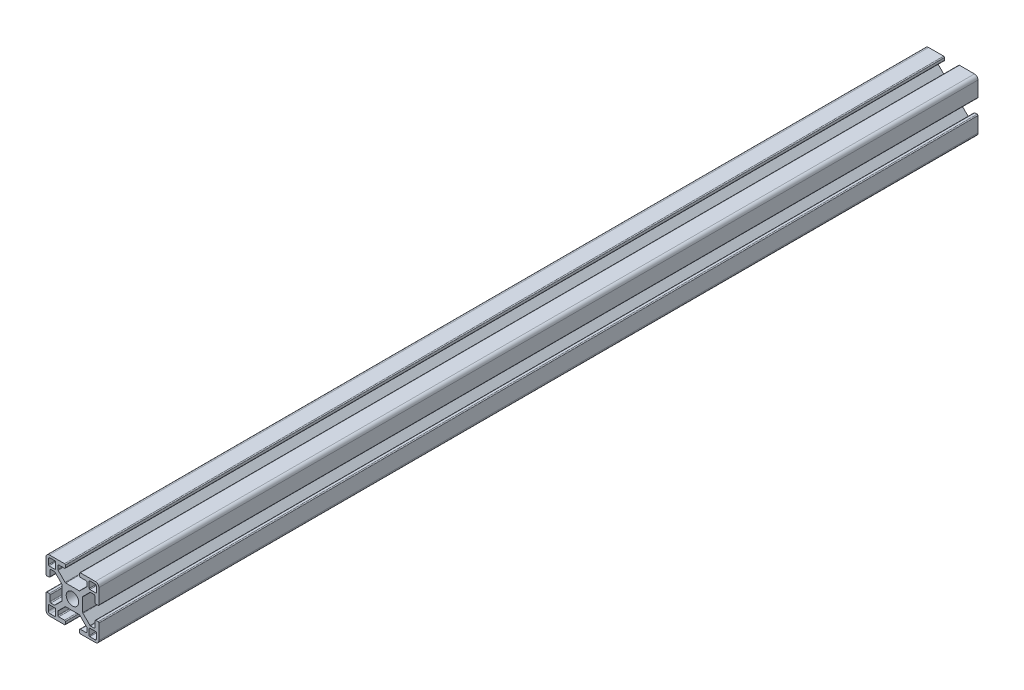
from build123d import *

# Parameters (mm, degrees)
SKETCH1_R           = 3.52998588
BOSS_EXTRUDE1_DEPTH = 249.32


with BuildPart() as part:
    # Sketch1 → Boss-Extrude1 (new, symmetric)
    with BuildSketch(Plane.XY):
        with BuildLine():
            Line((14.49994, -4), (13.24247465, -4))
            ThreePointArc((13.24247465, -4), (12.88892126, -4.146446609), (12.74247465, -4.5))
            Line((12.74247465, -4.5), (12.74247465, -7.732519321))
            ThreePointArc((12.74247465, -7.732519321), (12.602449697, -8.097296796), (12.242781236, -8.249967))
            Line((12.242781236, -8.249967), (10.260188032, -8.249967))
            ThreePointArc((10.260188032, -8.249967), (10.068847082, -8.211906919), (9.906636056, -8.103520976))
            Line((9.906636056, -8.103520976), (5.981117769, -4.178002689))
            ThreePointArc((5.981117769, -4.178002689), (5.872731827, -4.015791664), (5.834671745, -3.824450713))
            Line((5.834671745, -3.824450713), (5.834671745, -1.01249595))
            Line((5.834671745, -1.01249595), (5.834671745, 0.88749645))
            Line((5.834671745, 0.88749645), (5.834671745, 3.824450713))
            ThreePointArc((5.834671745, 3.824450713), (5.872731827, 4.015791664), (5.981117769, 4.178002689))
            Line((5.981117769, 4.178002689), (9.906636056, 8.103520976))
            ThreePointArc((9.906636056, 8.103520976), (10.068847082, 8.211906919), (10.260188032, 8.249967))
            Line((10.260188032, 8.249967), (12.242781236, 8.249967))
            ThreePointArc((12.242781236, 8.249967), (12.602449697, 8.097296796), (12.74247465, 7.732519321))
            Line((12.74247465, 7.732519321), (12.74247465, 4.5))
            ThreePointArc((12.74247465, 4.5), (12.88892126, 4.146446609), (13.24247465, 4))
            Line((13.24247465, 4), (14.49994, 4))
            ThreePointArc((14.49994, 4), (14.853493391, 4.146446609), (14.99994, 4.5))
            Line((14.99994, 4.5), (14.99994, 12.999948))
            ThreePointArc((14.99994, 12.999948), (14.414155906, 14.414155906), (12.999948, 14.99994))
            Line((12.999948, 14.99994), (4.5, 14.99994))
            ThreePointArc((4.5, 14.99994), (4.146446609, 14.853493391), (4, 14.49994))
            Line((4, 14.49994), (4, 13.24247465))
            ThreePointArc((4, 13.24247465), (4.146446609, 12.88892126), (4.5, 12.74247465))
            Line((4.5, 12.74247465), (7.732519321, 12.74247465))
            ThreePointArc((7.732519321, 12.74247465), (8.097296796, 12.602449697), (8.249967, 12.242781236))
            Line((8.249967, 12.242781236), (8.249967, 10.260188032))
            ThreePointArc((8.249967, 10.260188032), (8.211906919, 10.068847082), (8.103520976, 9.906636056))
            Line((8.103520976, 9.906636056), (4.178002689, 5.981117769))
            ThreePointArc((4.178002689, 5.981117769), (4.015791664, 5.872731827), (3.824450713, 5.834671745))
            Line((3.824450713, 5.834671745), (0.9499962, 5.834671745))
            Line((0.9499962, 5.834671745), (-0.9499962, 5.834671745))
            Line((-0.9499962, 5.834671745), (-3.824450713, 5.834671745))
            ThreePointArc((-3.824450713, 5.834671745), (-4.015791664, 5.872731827), (-4.178002689, 5.981117769))
            Line((-4.178002689, 5.981117769), (-8.103520976, 9.906636056))
            ThreePointArc((-8.103520976, 9.906636056), (-8.211906919, 10.068847082), (-8.249967, 10.260188032))
            Line((-8.249967, 10.260188032), (-8.249967, 12.242781236))
            ThreePointArc((-8.249967, 12.242781236), (-8.097296796, 12.602449697), (-7.732519321, 12.74247465))
            Line((-7.732519321, 12.74247465), (-4.5, 12.74247465))
            ThreePointArc((-4.5, 12.74247465), (-4.146446609, 12.88892126), (-4, 13.24247465))
            Line((-4, 13.24247465), (-4, 14.49994))
            ThreePointArc((-4, 14.49994), (-4.146446609, 14.853493391), (-4.5, 14.99994))
            Line((-4.5, 14.99994), (-12.999948, 14.99994))
            ThreePointArc((-12.999948, 14.99994), (-14.414155906, 14.414155906), (-14.99994, 12.999948))
            Line((-14.99994, 12.999948), (-14.99994, 4.5))
            ThreePointArc((-14.99994, 4.5), (-14.853493391, 4.146446609), (-14.49994, 4))
            Line((-14.49994, 4), (-13.24247465, 4))
            ThreePointArc((-13.24247465, 4), (-12.88892126, 4.146446609), (-12.74247465, 4.5))
            Line((-12.74247465, 4.5), (-12.74247465, 7.732519321))
            ThreePointArc((-12.74247465, 7.732519321), (-12.602449697, 8.097296796), (-12.242781236, 8.249967))
            Line((-12.242781236, 8.249967), (-10.260188032, 8.249967))
            ThreePointArc((-10.260188032, 8.249967), (-10.068847082, 8.211906919), (-9.906636056, 8.103520976))
            Line((-9.906636056, 8.103520976), (-5.981117769, 4.178002689))
            ThreePointArc((-5.981117769, 4.178002689), (-5.872731827, 4.015791664), (-5.834671745, 3.824450713))
            Line((-5.834671745, 3.824450713), (-5.834671745, 0.88749645))
            Line((-5.834671745, 0.88749645), (-5.834671745, -1.01249595))
            Line((-5.834671745, -1.01249595), (-5.834671745, -3.824450713))
            ThreePointArc((-5.834671745, -3.824450713), (-5.872731827, -4.015791664), (-5.981117769, -4.178002689))
            Line((-5.981117769, -4.178002689), (-9.906636056, -8.103520976))
            ThreePointArc((-9.906636056, -8.103520976), (-10.068847082, -8.211906919), (-10.260188032, -8.249967))
            Line((-10.260188032, -8.249967), (-12.242781236, -8.249967))
            ThreePointArc((-12.242781236, -8.249967), (-12.602449697, -8.097296796), (-12.74247465, -7.732519321))
            Line((-12.74247465, -7.732519321), (-12.74247465, -4.5))
            ThreePointArc((-12.74247465, -4.5), (-12.88892126, -4.146446609), (-13.24247465, -4))
            Line((-13.24247465, -4), (-14.49994, -4))
            ThreePointArc((-14.49994, -4), (-14.853493391, -4.146446609), (-14.99994, -4.5))
            Line((-14.99994, -4.5), (-14.99994, -12.999948))
            ThreePointArc((-14.99994, -12.999948), (-14.414155906, -14.414155906), (-12.999948, -14.99994))
            Line((-12.999948, -14.99994), (-4.5, -14.99994))
            ThreePointArc((-4.5, -14.99994), (-4.146446609, -14.853493391), (-4, -14.49994))
            Line((-4, -14.49994), (-4, -13.24247465))
            ThreePointArc((-4, -13.24247465), (-4.146446609, -12.88892126), (-4.5, -12.74247465))
            Line((-4.5, -12.74247465), (-7.732519321, -12.74247465))
            ThreePointArc((-7.732519321, -12.74247465), (-8.097296796, -12.602449697), (-8.249967, -12.242781236))
            Line((-8.249967, -12.242781236), (-8.249967, -10.260188032))
            ThreePointArc((-8.249967, -10.260188032), (-8.211906919, -10.068847082), (-8.103520976, -9.906636056))
            Line((-8.103520976, -9.906636056), (-4.178002689, -5.981117769))
            ThreePointArc((-4.178002689, -5.981117769), (-4.015791664, -5.872731827), (-3.824450713, -5.834671745))
            Line((-3.824450713, -5.834671745), (-0.9499962, -5.834671745))
            Line((-0.9499962, -5.834671745), (0.9499962, -5.834671745))
            Line((0.9499962, -5.834671745), (3.824450713, -5.834671745))
            ThreePointArc((3.824450713, -5.834671745), (4.015791664, -5.872731827), (4.178002689, -5.981117769))
            Line((4.178002689, -5.981117769), (8.103520976, -9.906636056))
            ThreePointArc((8.103520976, -9.906636056), (8.211906919, -10.068847082), (8.249967, -10.260188032))
            Line((8.249967, -10.260188032), (8.249967, -12.242781236))
            ThreePointArc((8.249967, -12.242781236), (8.097296796, -12.602449697), (7.732519321, -12.74247465))
            Line((7.732519321, -12.74247465), (4.5, -12.74247465))
            ThreePointArc((4.5, -12.74247465), (4.146446609, -12.88892126), (4, -13.24247465))
            Line((4, -13.24247465), (4, -14.49994))
            ThreePointArc((4, -14.49994), (4.146446609, -14.853493391), (4.5, -14.99994))
            Line((4.5, -14.99994), (12.999948, -14.99994))
            ThreePointArc((12.999948, -14.99994), (14.414155906, -14.414155906), (14.99994, -12.999948))
            Line((14.99994, -12.999948), (14.99994, -4.5))
            ThreePointArc((14.99994, -4.5), (14.853493391, -4.146446609), (14.49994, -4))
        make_face()
        Circle(SKETCH1_R, mode=Mode.SUBTRACT)
        with BuildLine():
            Line((-12.6999492, -13.6999452), (-9.880960476, -13.6999452))
            ThreePointArc((-9.880960476, -13.6999452), (-9.61155387, -13.58835333), (-9.499962, -13.318946724))
            Line((-9.499962, -13.318946724), (-9.499962, -9.87996048))
            ThreePointArc((-9.499962, -9.87996048), (-9.611260978, -9.611260978), (-9.87996048, -9.499962))
            Line((-9.87996048, -9.499962), (-13.318946724, -9.499962))
            ThreePointArc((-13.318946724, -9.499962), (-13.58835333, -9.61155387), (-13.6999452, -9.880960476))
            Line((-13.6999452, -9.880960476), (-13.6999452, -12.6999492))
            ThreePointArc((-13.6999452, -12.6999492), (-13.407053153, -13.407053153), (-12.6999492, -13.6999452))
        make_face(mode=Mode.SUBTRACT)
        with BuildLine():
            Line((13.6999452, -12.6999492), (13.6999452, -9.880960476))
            ThreePointArc((13.6999452, -9.880960476), (13.58835333, -9.61155387), (13.318946724, -9.499962))
            Line((13.318946724, -9.499962), (9.87996048, -9.499962))
            ThreePointArc((9.87996048, -9.499962), (9.611260978, -9.611260978), (9.499962, -9.87996048))
            Line((9.499962, -9.87996048), (9.499962, -13.318946724))
            ThreePointArc((9.499962, -13.318946724), (9.61155387, -13.58835333), (9.880960476, -13.6999452))
            Line((9.880960476, -13.6999452), (12.6999492, -13.6999452))
            ThreePointArc((12.6999492, -13.6999452), (13.407053153, -13.407053153), (13.6999452, -12.6999492))
        make_face(mode=Mode.SUBTRACT)
        with BuildLine():
            Line((9.87996048, 9.499962), (13.318946724, 9.499962))
            ThreePointArc((13.318946724, 9.499962), (13.58835333, 9.61155387), (13.6999452, 9.880960476))
            Line((13.6999452, 9.880960476), (13.6999452, 12.6999492))
            ThreePointArc((13.6999452, 12.6999492), (13.407053153, 13.407053153), (12.6999492, 13.6999452))
            Line((12.6999492, 13.6999452), (9.880960476, 13.6999452))
            ThreePointArc((9.880960476, 13.6999452), (9.61155387, 13.58835333), (9.499962, 13.318946724))
            Line((9.499962, 13.318946724), (9.499962, 9.87996048))
            ThreePointArc((9.499962, 9.87996048), (9.611260978, 9.611260978), (9.87996048, 9.499962))
        make_face(mode=Mode.SUBTRACT)
        with BuildLine():
            Line((-13.6999452, 12.6999492), (-13.6999452, 9.880960476))
            ThreePointArc((-13.6999452, 9.880960476), (-13.58835333, 9.61155387), (-13.318946724, 9.499962))
            Line((-13.318946724, 9.499962), (-9.87996048, 9.499962))
            ThreePointArc((-9.87996048, 9.499962), (-9.611260978, 9.611260978), (-9.499962, 9.87996048))
            Line((-9.499962, 9.87996048), (-9.499962, 13.318946724))
            ThreePointArc((-9.499962, 13.318946724), (-9.61155387, 13.58835333), (-9.880960476, 13.6999452))
            Line((-9.880960476, 13.6999452), (-12.6999492, 13.6999452))
            ThreePointArc((-12.6999492, 13.6999452), (-13.407053153, 13.407053153), (-13.6999452, 12.6999492))
        make_face(mode=Mode.SUBTRACT)
    extrude(amount=BOSS_EXTRUDE1_DEPTH, both=True)


solid = part.part
